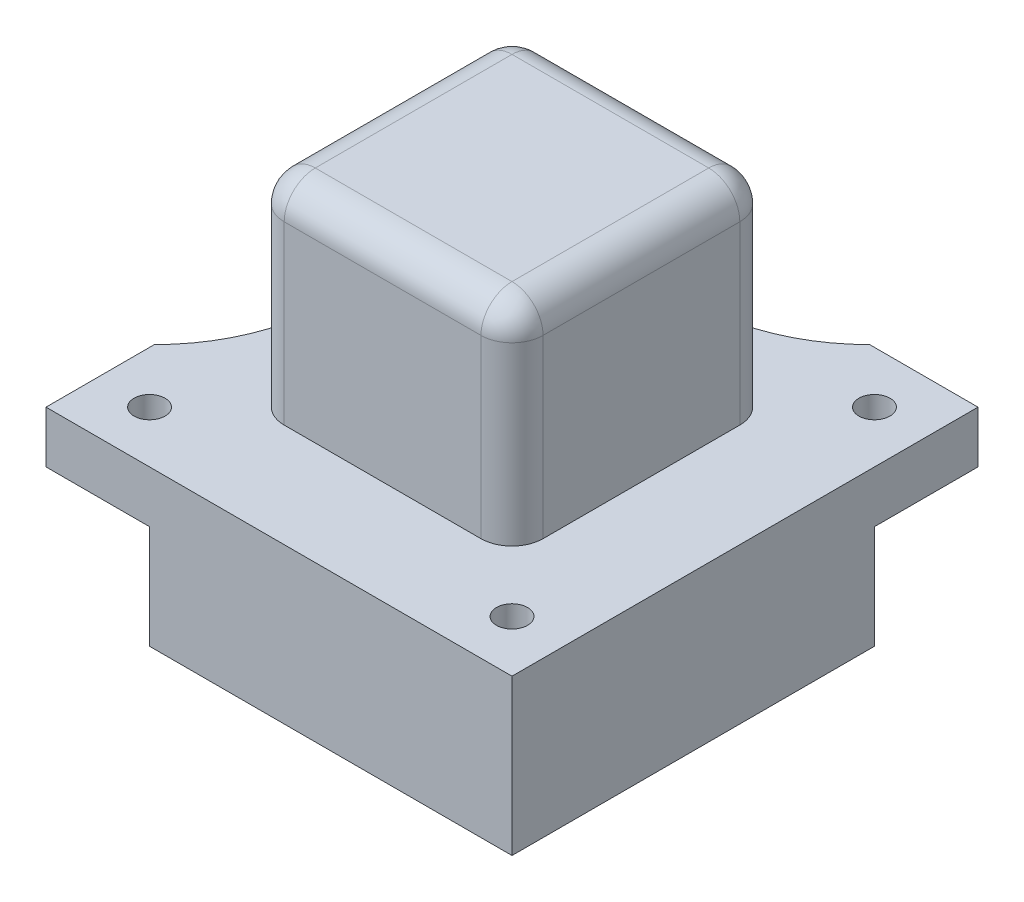
from build123d import *

# Parameters (mm, degrees)
SKETCH1_W               = 45
SKETCH1_H               = 45
BOSS_EXTRUDE1_DEPTH     = 15
CUT_EXTRUDE1_DEPTH      = 10
CUT_EXTRUDE2_DEPTH      = 38.243644172
CUT_EXTRUDE2_DEPTH_BACK = 38.243644172
CUT_EXTRUDE3_DEPTH      = 2.5
SKETCH5_W               = 25
SKETCH5_H               = 25
BOSS_EXTRUDE2_DEPTH     = 20
FILLET1_R               = 3
SKETCH6_R               = 6
CUT_EXTRUDE4_DEPTH      = 28.99918
SKETCH7_W               = 13
SKETCH7_H               = 13
CUT_EXTRUDE5_DEPTH      = 13
FILLET2_R               = 3
CUT_EXTRUDE6_DEPTH      = 42.074189356
CUT_EXTRUDE6_DEPTH_BACK = 42.074189356
SKETCH8_R               = 1.5


with BuildPart() as part:
    # Sketch1 → Boss-Extrude1 (new body)
    with BuildSketch(Plane(origin=(0, 0, 0), x_dir=(1, 0, 0), z_dir=(0, 1, 0))):
        with Locations((0.699698795, 4.865361446)):
            Rectangle(SKETCH1_W, SKETCH1_H)
    extrude(amount=BOSS_EXTRUDE1_DEPTH)

    # Sketch2 → Cut-Extrude1 (cut)
    with BuildSketch(Plane.XZ):
        Polygon((-21.800301205, 17.634638554), (-11.800301205, 17.634638554), (-11.800301205, -17.365361446), (23.199698795, -17.365361446), (23.199698795, -27.365361446), (-21.800301205, -27.365361446), align=None)
    extrude(amount=-CUT_EXTRUDE1_DEPTH, mode=Mode.SUBTRACT)

    # Sketch3 → Cut-Extrude2 (cut, two sides: drawn at the far end of the back side and taken through both)
    with BuildSketch(Plane.XZ.offset(-10).offset(-CUT_EXTRUDE2_DEPTH_BACK)):
        with BuildLine():
            Line((-11.340301205, -27.365361446), (12.739698795, -27.365361446))
            ThreePointArc((12.739698795, -27.365361446), (0.699698795, -22.366961339), (-11.340301205, -27.365361446))
        make_face()
        with BuildLine():
            Line((-21.800301205, 7.174638554), (-21.800301205, -16.905361446))
            ThreePointArc((-21.800301205, -16.905361446), (-16.801901098, -4.865361446), (-21.800301205, 7.174638554))
        make_face()
    extrude(amount=CUT_EXTRUDE2_DEPTH + CUT_EXTRUDE2_DEPTH_BACK, mode=Mode.SUBTRACT)

    # Sketch4 → Cut-Extrude3 (cut)
    with BuildSketch(Plane.XZ.offset(-10)):
        with BuildLine():
            Line((-21.800301205, -17.465361446), (-21.800301205, -27.365361446))
            Line((-21.800301205, -27.365361446), (-11.900301205, -27.365361446))
            ThreePointArc((-11.900301205, -27.365361446), (-12.153386497, -17.718446738), (-21.800301205, -17.465361446))
        make_face()
    extrude(amount=-CUT_EXTRUDE3_DEPTH, mode=Mode.SUBTRACT)

    # Sketch5 → Boss-Extrude2 (add)
    with BuildSketch(Plane(origin=(0, 15, 0), x_dir=(1, 0, 0), z_dir=(0, 1, 0))):
        with Locations((0.699698795, 4.865361446)):
            Rectangle(SKETCH5_W, SKETCH5_H)
    extrude(amount=BOSS_EXTRUDE2_DEPTH)

    # Fillet1
    fillet1_edges = [part.edges().sort_by_distance(p)[0] for p in [
        (-11.800301205, 25, -17.365361446),
        (-11.800301205, 25, 7.634638554),
        (13.199698795, 25, 7.634638554),
        (13.199698795, 25, -17.365361446),
        (-11.800301205, 35, -4.865361446),
        (0.699698795, 35, 7.634638554),
        (13.199698795, 35, -4.865361446),
        (0.699698795, 35, -17.365361446),
    ]]
    fillet(fillet1_edges, radius=FILLET1_R)

    # Sketch6 → Cut-Extrude4 (cut)
    with BuildSketch(Plane(origin=(0, 0, 0), x_dir=(-1, 0, 0), z_dir=(0, -1, 0))):
        with Locations(Location((-0.699698795, 4.865361446, 0), (0, 0, 90))):
            Circle(SKETCH6_R)
    extrude(amount=-CUT_EXTRUDE4_DEPTH, mode=Mode.SUBTRACT)

    # Sketch7 → Cut-Extrude5 (cut)
    with BuildSketch(Plane.XZ.offset(-28.99918)):
        with Locations((0.699698795, -4.865361446)):
            Rectangle(SKETCH7_W, SKETCH7_H)
    extrude(amount=CUT_EXTRUDE5_DEPTH, mode=Mode.SUBTRACT)

    # Fillet2
    fillet2_edges = [part.edges().sort_by_distance(p)[0] for p in [
        (-5.800301205, 28.99918, -4.865361446),
        (-5.800301205, 22.49918, 1.634638554),
        (0.699698795, 28.99918, -11.365361446),
        (-5.800301205, 22.49918, -11.365361446),
        (7.199698795, 28.99918, -4.865361446),
        (7.199698795, 22.49918, -11.365361446),
        (0.699698795, 28.99918, 1.634638554),
        (7.199698795, 22.49918, 1.634638554),
    ]]
    fillet(fillet2_edges, radius=FILLET2_R)

    # Sketch8 → Cut-Extrude6 (cut, two sides: drawn at the far end of the back side and taken through both)
    with BuildSketch(Plane(origin=(0, 15, 0), x_dir=(1, 0, 0), z_dir=(0, 1, 0)).offset(-CUT_EXTRUDE6_DEPTH_BACK)):
        with Locations(Location((-16.800301205, 22.365361446, 0), (0, 0, 270))):
            Circle(SKETCH8_R)
        with Locations(Location((18.199698795, 22.365361446, 0), (0, 0, 270))):
            Circle(SKETCH8_R)
        with Locations(Location((18.199698795, -12.634638554, 0), (0, 0, 270))):
            Circle(SKETCH8_R)
        with Locations(Location((-16.800301205, -12.634638554, 0), (0, 0, 270))):
            Circle(SKETCH8_R)
    extrude(amount=CUT_EXTRUDE6_DEPTH + CUT_EXTRUDE6_DEPTH_BACK, mode=Mode.SUBTRACT)


solid = part.part
